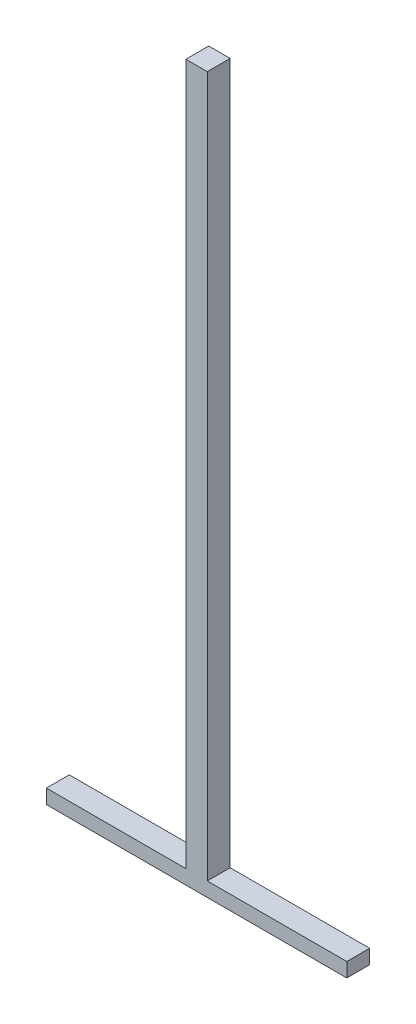
from build123d import *

# Parameters (mm, degrees)
SKETCH_1_W          = 42
SKETCH_1_H          = 3.2
EXTRUDE_1_DEPTH     = 100
SKETCH_4_W          = 19.5
SKETCH_4_H          = 98
CUT_EXTRUDE_2_DEPTH = 112.45876677


with BuildPart() as part:
    # 草图1 → 凸台-拉伸1 (new body)
    with BuildSketch(Plane(origin=(0, 0, 0), x_dir=(1, 0, 0), z_dir=(0, 1, 0))):
        with Locations((-28.120430474, -21.18283124)):
            Rectangle(SKETCH_1_W, SKETCH_1_H)
    extrude(amount=EXTRUDE_1_DEPTH)

    # 草图4 → 切除-拉伸2 (cut, through all)
    with BuildSketch(Plane(origin=(0, 0, 19.58283124), x_dir=(-1, 0, 0), z_dir=(0, 0, -1))):
        with Locations((39.370430474, 51)):
            Rectangle(SKETCH_4_W, SKETCH_4_H)
        with Locations((16.870430474, 51)):
            Rectangle(SKETCH_4_W, SKETCH_4_H)
    extrude(amount=-CUT_EXTRUDE_2_DEPTH, mode=Mode.SUBTRACT)


solid = part.part
